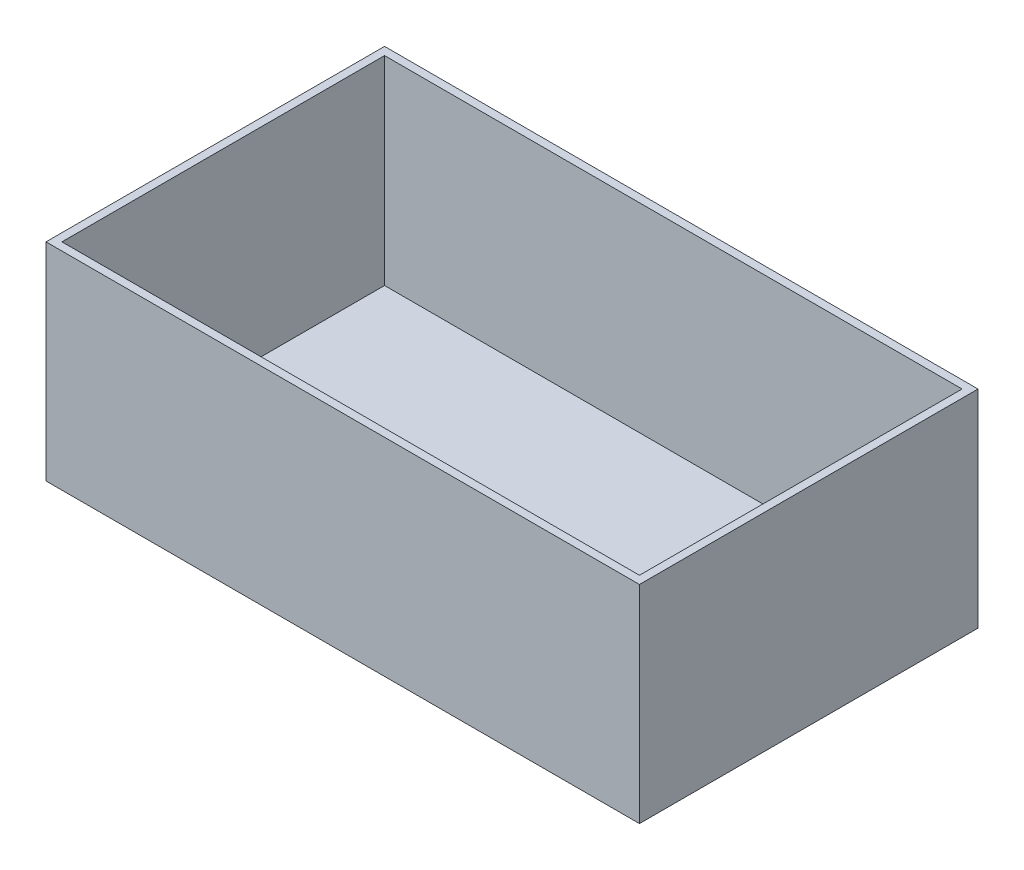
from build123d import *

# Parameters (mm, degrees)
SKETCH1_W           = 149
SKETCH1_H           = 85
BOSS_EXTRUDE1_DEPTH = 2
SKETCH2_W           = 149
SKETCH2_H           = 85
SKETCH2_W_2         = 145
SKETCH2_H_2         = 81
BOSS_EXTRUDE2_DEPTH = 50


with BuildPart() as part:
    # Sketch1 → Boss-Extrude1 (new body)
    with BuildSketch(Plane(origin=(0, 0, 0), x_dir=(1, 0, 0), z_dir=(0, 1, 0))):
        Rectangle(SKETCH1_W, SKETCH1_H)
    extrude(amount=BOSS_EXTRUDE1_DEPTH)

    # Sketch2 → Boss-Extrude2 (add)
    with BuildSketch(Plane(origin=(0, 2, 0), x_dir=(1, 0, 0), z_dir=(0, 1, 0))):
        Rectangle(SKETCH2_W, SKETCH2_H)
        Rectangle(SKETCH2_W_2, SKETCH2_H_2, mode=Mode.SUBTRACT)
    extrude(amount=BOSS_EXTRUDE2_DEPTH)


solid = part.part
